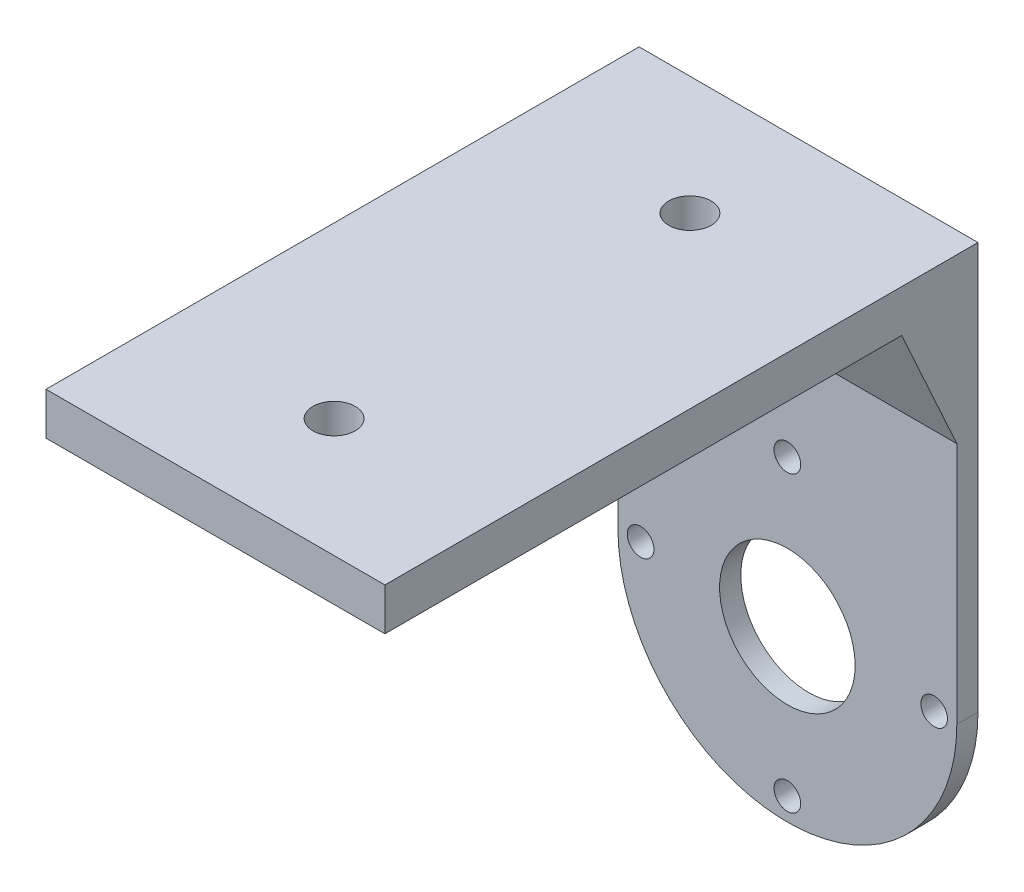
from build123d import *

# Parameters (mm, degrees)
SKETCH1_R           = 10.16
SKETCH1_R_2         = 2
BOSS_EXTRUDE1_DEPTH = 3.175
SKETCH2_W           = 50.8
SKETCH2_H           = 88.9
SKETCH2_R           = 3.175
BOSS_EXTRUDE2_DEPTH = 6.35
BOSS_EXTRUDE3_DEPTH = 50.8


with BuildPart() as part:
    # Sketch1 → Boss-Extrude1 (new body)
    with BuildSketch(Plane.XY):
        with BuildLine():
            Line((-25.4, 0), (-25.4, 60.96))
            Line((-25.4, 60.96), (25.4, 60.96))
            Line((25.4, 60.96), (25.4, 0))
            ThreePointArc((25.4, 0), (0, -25.4), (-25.4, 0))
        make_face()
        Circle(SKETCH1_R, mode=Mode.SUBTRACT)
        with Locations((0, -22)):
            Circle(SKETCH1_R_2, mode=Mode.SUBTRACT)
        with Locations((-22, 0)):
            Circle(SKETCH1_R_2, mode=Mode.SUBTRACT)
        with Locations((0, 22)):
            Circle(SKETCH1_R_2, mode=Mode.SUBTRACT)
        with Locations((22, 0)):
            Circle(SKETCH1_R_2, mode=Mode.SUBTRACT)
    extrude(amount=BOSS_EXTRUDE1_DEPTH)

    # Sketch2 → Boss-Extrude2 (add)
    with BuildSketch(Plane(origin=(0, 60.96, 0), x_dir=(1, 0, 0), z_dir=(0, 1, 0))):
        with Locations((0, -44.45)):
            Rectangle(SKETCH2_W, SKETCH2_H)
        with Locations(Location((0, -17.78, 0), (0, 0, 270))):
            Circle(SKETCH2_R, mode=Mode.SUBTRACT)
        with Locations(Location((0, -71.12, 0), (0, 0, 270))):
            Circle(SKETCH2_R, mode=Mode.SUBTRACT)
    extrude(amount=-BOSS_EXTRUDE2_DEPTH)

    # Sketch3 → Boss-Extrude3 (add)
    with BuildSketch(Plane.ZY.offset(25.4)):
        Polygon((11.441642041, 54.61), (3.175, 36.439571989), (3.175, 54.61), align=None)
    extrude(amount=-BOSS_EXTRUDE3_DEPTH)


solid = part.part
